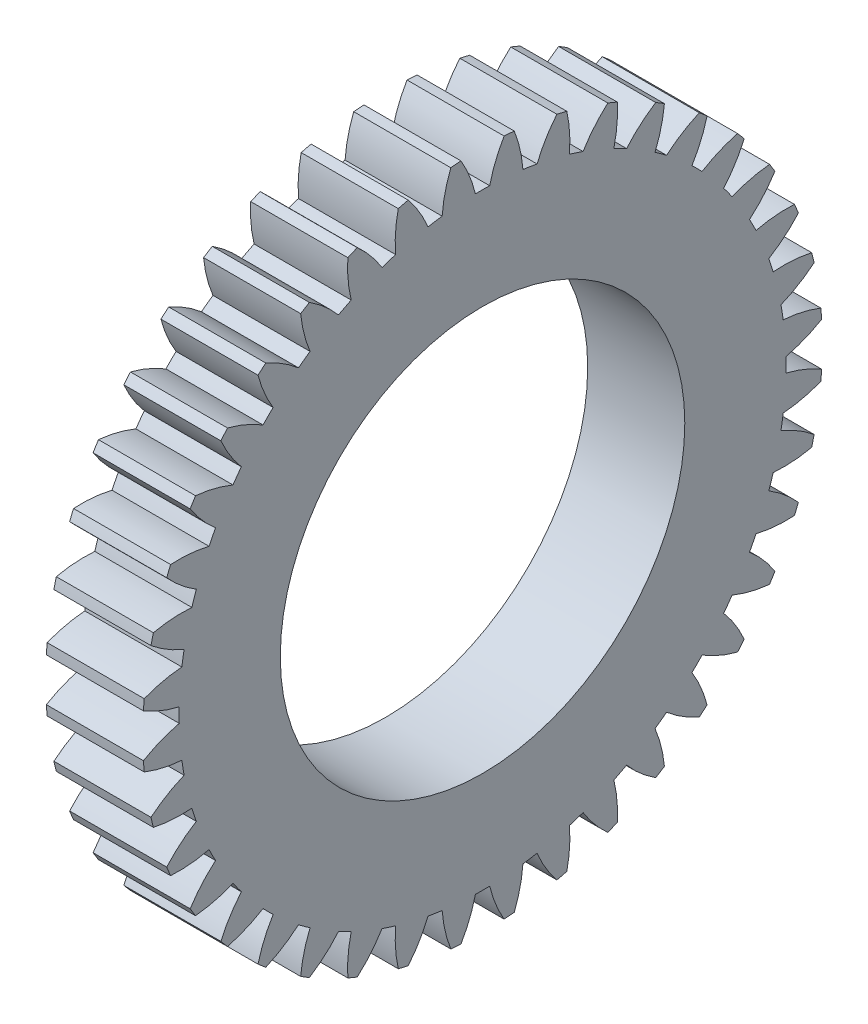
from build123d import *

# Parameters (mm, degrees)
BASPROSKE_W     = 12
BASPROSKE_H     = 42
TOOTHCUT_DEPTH  = 61.59702963
TEETHCUTS_COUNT = 40
TEETHCUTS_ANGLE = 351
BORSKE_R        = 25
BORE_DEPTH      = 50.0000508


with BuildPart() as part:
    # BasProSke → Base-Revolve (revolve)
    with BuildSketch(Plane(origin=(0, 0, 0), x_dir=(1, 0, 0), z_dir=(0, 1, 0)), mode=Mode.PRIVATE) as base_revolve_sk:
        with Locations((6, 21)):
            Rectangle(BASPROSKE_W, BASPROSKE_H)
    revolve(base_revolve_sk.sketch.rotate(Axis((-10, 0, 0), (1, 0, 0)), 180), axis=Axis((-10, 0, 0), (1, 0, 0)))

    # TooCutSke → ToothCut (cut, through all)
    with BuildSketch(Plane(origin=(0, 0, 0), x_dir=(0, 0, -1), z_dir=(1, 0, 0))):
        with BuildLine():
            ThreePointArc((0.882812088, 37.488606854), (0, 37.499), (-0.882812088, 37.488606854))
            ThreePointArc((-0.882812088, 37.488606854), (-1.612748684, 39.782000434), (-2.678427154, 41.939960338))
            ThreePointArc((-2.678427154, 41.939960338), (0, 42.0254), (2.678427154, 41.939960338))
            ThreePointArc((2.678427154, 41.939960338), (1.612748684, 39.782000434), (0.882812088, 37.488606854))
        make_face()
    toothcut = extrude(amount=TOOTHCUT_DEPTH, mode=Mode.SUBTRACT)

    # TeethCuts: ToothCut ×40 about axis
    teethcuts_axis = Axis((-10, 0, 0), (1, 0, 0))
    for i in range(1, TEETHCUTS_COUNT):
        add(toothcut.rotate(teethcuts_axis, i * TEETHCUTS_ANGLE / (TEETHCUTS_COUNT - 1)), mode=Mode.SUBTRACT)

    # BorSke → Bore (cut, symmetric)
    with BuildSketch(Plane(origin=(0, 0, 0), x_dir=(0, 0, -1), z_dir=(1, 0, 0))):
        with Locations(Location((0, 0, 0), (0, 0, 180))):
            Circle(BORSKE_R)
    extrude(amount=BORE_DEPTH, both=True, mode=Mode.SUBTRACT)


solid = part.part
